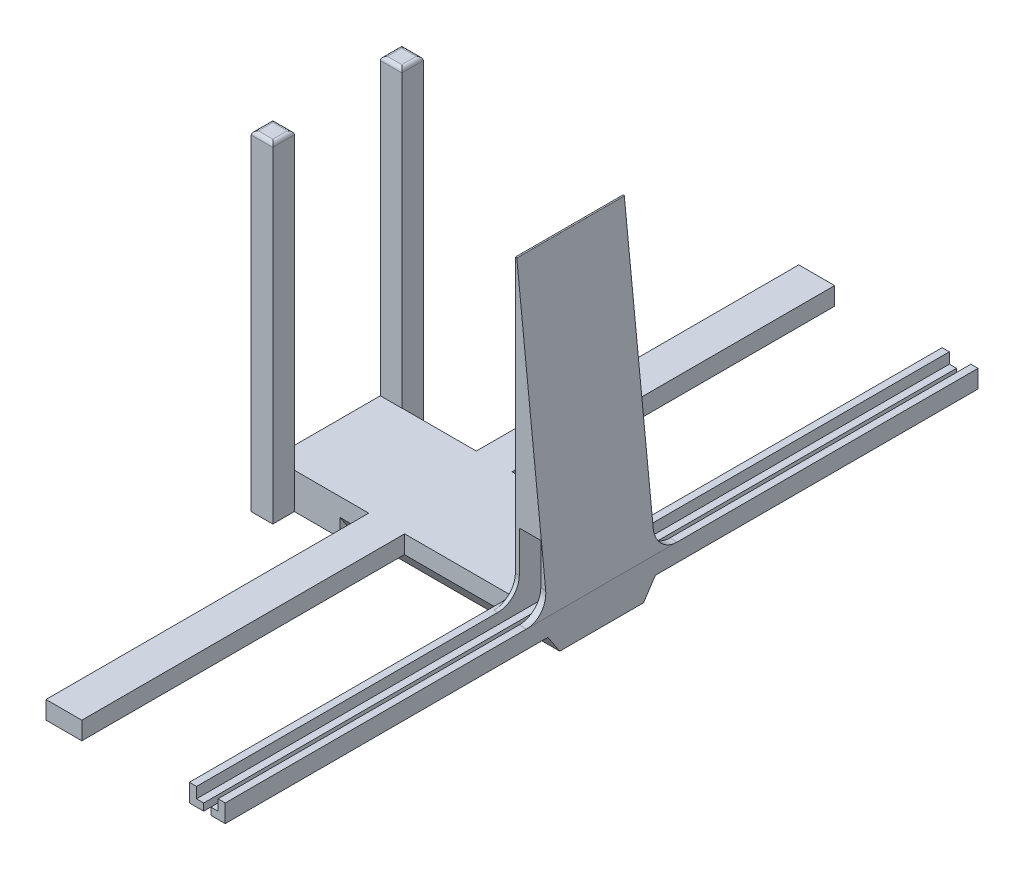
from build123d import *

# Parameters (mm, degrees)
SKETCH1_W           = 5
SKETCH1_H           = 105
BOSS_EXTRUDE1_DEPTH = 5
BOSS_EXTRUDE2_START = 129
BOSS_EXTRUDE2_DEPTH = 15
BOSS_EXTRUDE3_START = 129
SKETCH3_W           = 33.371379062
SKETCH3_H           = 5
BOSS_EXTRUDE3_DEPTH = 15
SKETCH4_W           = 3
SKETCH4_H           = 3.016632821
SKETCH4_H_2         = 3
BOSS_EXTRUDE4_DEPTH = 46
FILLET1_R           = 0.5
FILLET2_R           = 0.1
FILLET3_R           = 3
LPATTERN2_COUNT     = 2
LPATTERN2_PITCH     = 20
CUT_EXTRUDE3_DEPTH  = 29
CUT_EXTRUDE4_DEPTH  = 106


with BuildPart() as part:
    # Sketch1 → Boss-Extrude1 (new body)
    with BuildSketch(Plane(origin=(0, -9.496519724, 0), x_dir=(1, 0, 0), z_dir=(0, 1, 0))):
        with Locations((177.597354305, -136.516632821)):
            Rectangle(SKETCH1_W, SKETCH1_H)
    boss_extrude1 = extrude(amount=BOSS_EXTRUDE1_DEPTH)

    # Sketch2 → Boss-Extrude2 (add)
    with BuildSketch(Plane(origin=(0, -9.496519724, 0), x_dir=(1, 0, 0), z_dir=(0, 0, 1)).offset(BOSS_EXTRUDE2_START)):
        Polygon((180.097354305, 5), (175.549258031, 48.019997969), (175.549258031, 5), align=None)
    extrude(amount=BOSS_EXTRUDE2_DEPTH)

    # Sketch3 → Boss-Extrude3 (add)
    with BuildSketch(Plane(origin=(0, -9.496519724, 0), x_dir=(1, 0, 0), z_dir=(0, 0, 1)).offset(BOSS_EXTRUDE3_START)):
        with Locations((158.411664774, 2.5)):
            Rectangle(SKETCH3_W, SKETCH3_H)
    extrude(amount=BOSS_EXTRUDE3_DEPTH)

    # Sketch4 → Boss-Extrude4 (add)
    with BuildSketch(Plane(origin=(0, -9.496519724, 0), x_dir=(1, 0, 0), z_dir=(0, 1, 0))):
        with Locations((143.225975243, -145.508316411)):
            Rectangle(SKETCH4_W, SKETCH4_H)
        with Locations((143.225975243, -127.516632821)):
            Rectangle(SKETCH4_W, SKETCH4_H_2)
    extrude(amount=BOSS_EXTRUDE4_DEPTH)

    # Fillet1
    fillet1_edges = [part.edges().sort_by_distance(p)[0] for p in [
        (144.725975243, 36.503480276, 145.50831641),
        (143.225975243, 36.503480276, 144),
        (141.725975243, 36.503480276, 145.50831641),
        (143.225975243, 36.503480276, 147.016632821),
        (144.725975243, 36.503480276, 127.516632821),
        (143.225975243, 36.503480276, 126.016632821),
        (141.725975243, 36.503480276, 127.516632821),
        (143.225975243, 36.503480276, 129.016632821),
    ]]
    fillet(fillet1_edges, radius=FILLET1_R)

    # Fillet2
    fillet2_edges = [part.edges().sort_by_distance(p)[0] for p in [
        (175.549258031, 38.523478245, 136.5),
    ]]
    fillet(fillet2_edges, radius=FILLET2_R)

    # Fillet3
    fillet3_edges = [part.edges().sort_by_distance(p)[0] for p in [
        (177.823306168, -4.496519724, 129),
        (177.823306168, -4.496519724, 144),
    ]]
    fillet(fillet3_edges, radius=FILLET3_R)

    # LPattern2: Boss-Extrude1 ×2
    with Locations(*[(-i * LPATTERN2_PITCH, 0, 0) for i in range(1, LPATTERN2_COUNT)]):
        add(boss_extrude1)

    # Sketch7 → Cut-Extrude3 (cut)
    with BuildSketch(Plane(origin=(180.097354305, 0, 0), x_dir=(0, 0, -1), z_dir=(1, 0, 0))):
        Polygon((-129.016632821, -6.996519724), (-130.674945216, -9.496519724), (-84.016632821, -9.496519724), (-84.016632821, -6.996519724), align=None)
        Polygon((-189.016632821, -6.996519724), (-189.016632821, -9.496519724), (-142.358320426, -9.496519724), (-144.016632821, -6.996519724), align=None)
    extrude(amount=-CUT_EXTRUDE3_DEPTH, mode=Mode.SUBTRACT)

    # Sketch11 → Cut-Extrude4 (cut)
    with BuildSketch(Plane(origin=(0, 0, 84.016632821), x_dir=(-1, 0, 0), z_dir=(0, 0, -1))):
        Polygon((-178.097354305, -6.996519724), (-178.097354305, -5.996519724), (-179.097354305, -5.996519724), (-179.097354305, 4.208174), (-176.097354305, 4.208174), (-176.097354305, -5.996519724), (-177.097354305, -5.996519724), (-177.097354305, -6.996519724), align=None)
    extrude(amount=-CUT_EXTRUDE4_DEPTH, mode=Mode.SUBTRACT)


solid = part.part
